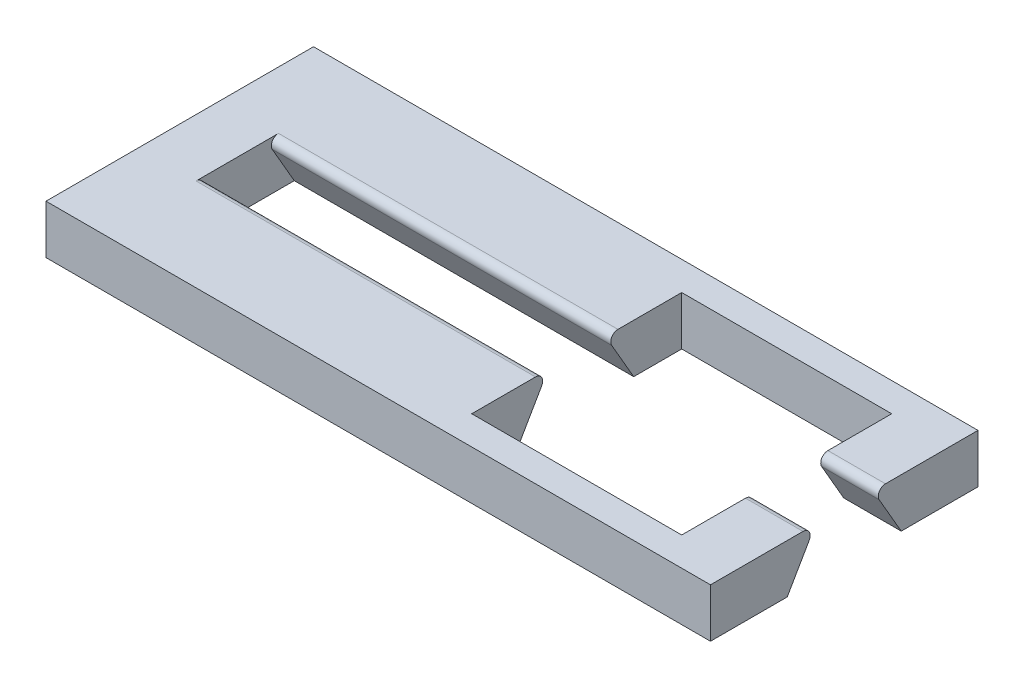
from build123d import *

# Parameters (mm, degrees)
SKETCH1_W           = 46.2
SKETCH1_H           = 18.6
BOSS_EXTRUDE1_DEPTH = 3.4
CUT_EXTRUDE1_DEPTH  = 42.2
SKETCH3_W           = 14.6
SKETCH3_H           = 14.6
CUT_EXTRUDE2_DEPTH  = 26.132847033
FILLET1_R           = 0.5


with BuildPart() as part:
    # Sketch1 → Boss-Extrude1 (new body)
    with BuildSketch(Plane(origin=(0, 0, 0), x_dir=(1, 0, 0), z_dir=(0, 1, 0))):
        Rectangle(SKETCH1_W, SKETCH1_H)
    extrude(amount=BOSS_EXTRUDE1_DEPTH)

    # Sketch2 → Cut-Extrude1 (cut)
    with BuildSketch(Plane(origin=(23.1, 0, 0), x_dir=(0, 0, -1), z_dir=(1, 0, 0))):
        Polygon((2, 3.4), (-2, 3.4), (-3.962990915, 0), (3.962990915, 0), align=None)
    extrude(amount=-CUT_EXTRUDE1_DEPTH, mode=Mode.SUBTRACT)

    # Sketch3 → Cut-Extrude2 (cut, through all)
    with BuildSketch(Plane(origin=(0, 3.4, 0), x_dir=(1, 0, 0), z_dir=(0, 1, 0))):
        with Locations((11.8, 0)):
            Rectangle(SKETCH3_W, SKETCH3_H)
    extrude(amount=-CUT_EXTRUDE2_DEPTH, mode=Mode.SUBTRACT)

    # Fillet1
    fillet1_edges = [part.edges().sort_by_distance(p)[0] for p in [
        (-7.3, 3.4, 2),
        (-7.3, 3.4, -2),
        (21.1, 3.4, -2),
        (21.1, 3.4, 2),
    ]]
    fillet(fillet1_edges, radius=FILLET1_R)


solid = part.part
